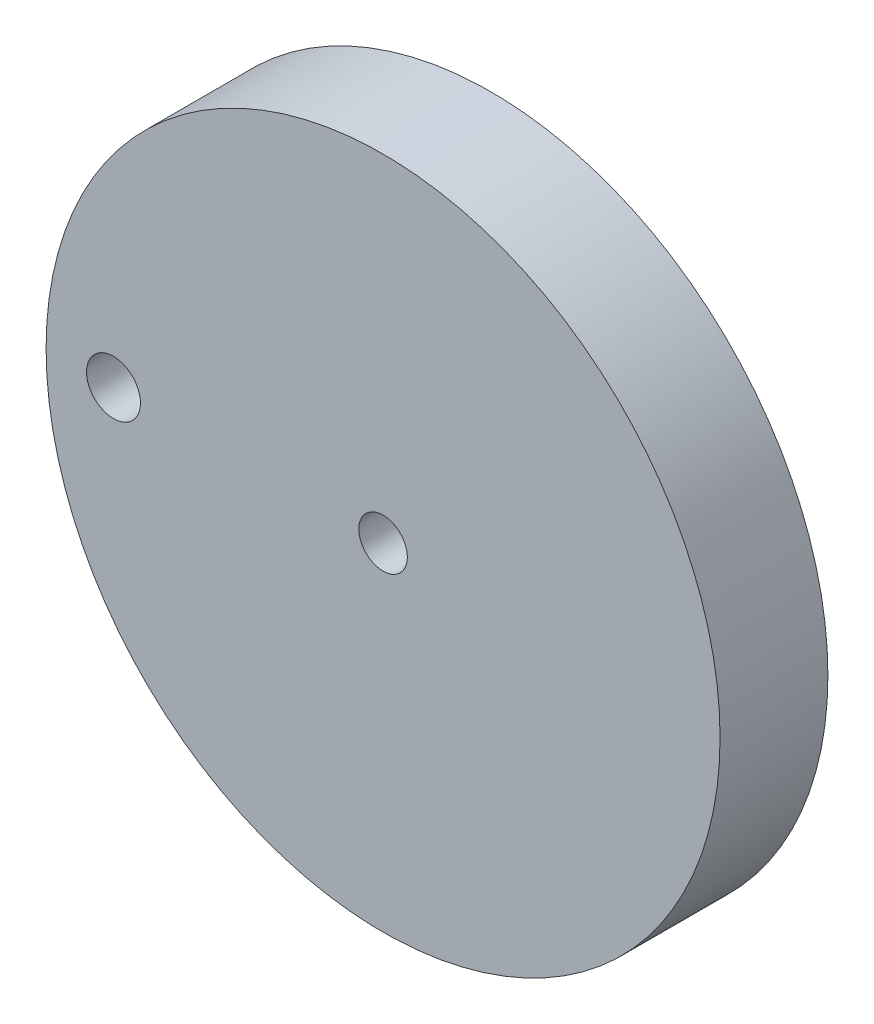
from build123d import *

# Parameters (mm, degrees)
SKETCH1_R           = 12.5
SKETCH1_R_2         = 0.9
SKETCH1_R_3         = 1
BOSS_EXTRUDE1_DEPTH = 4


with BuildPart() as part:
    # Sketch1 → Boss-Extrude1 (new body)
    with BuildSketch(Plane.XY):
        Circle(SKETCH1_R)
        Circle(SKETCH1_R_2, mode=Mode.SUBTRACT)
        with Locations((-10, 0)):
            Circle(SKETCH1_R_3, mode=Mode.SUBTRACT)
    extrude(amount=BOSS_EXTRUDE1_DEPTH)


solid = part.part
